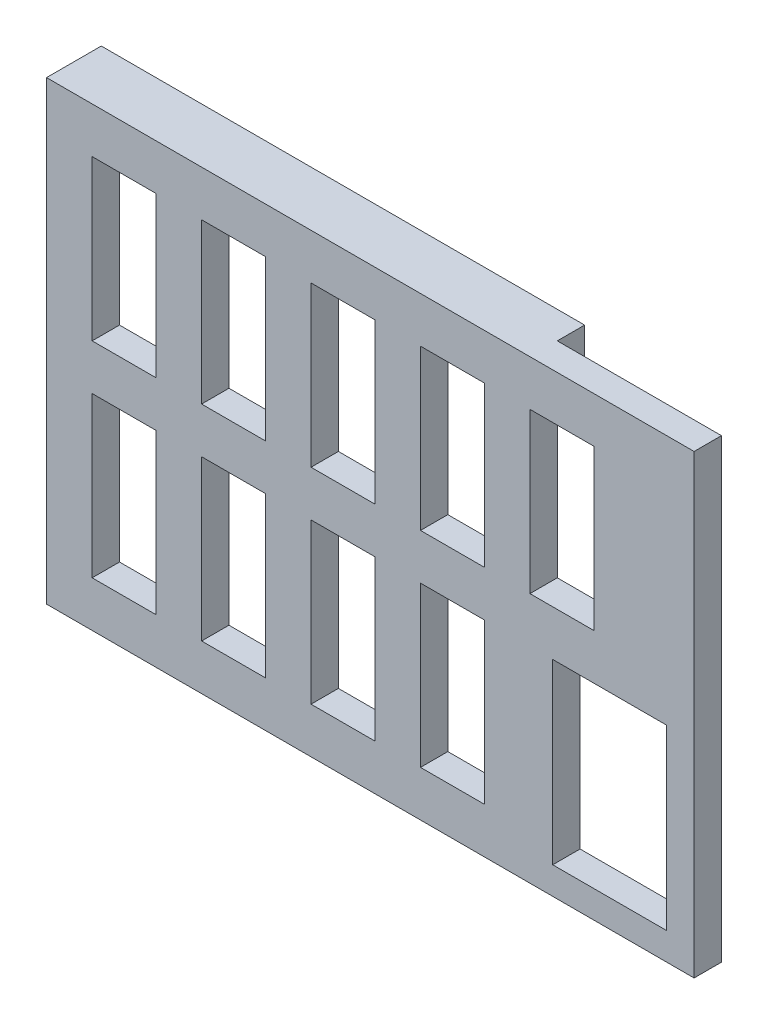
from build123d import *

# Parameters (mm, degrees)
EXTRUDE_1_DEPTH     = 5
SKETCH_2_W          = 53
SKETCH_2_H          = 3
EXTRUDE_2_DEPTH     = 3
SKETCH_3_W          = 53
SKETCH_3_H          = 50
EXTRUDE_3_DEPTH     = 3
SKETCH_4_W          = 3
SKETCH_4_H          = 50
EXTRUDE_4_DEPTH     = 18
SKETCH_5_W          = 7
SKETCH_5_H          = 17.5
CUT_EXTRUDE_1_DEPTH = 3
SKETCH_7_W          = 12.5
SKETCH_7_H          = 19.5
CUT_EXTRUDE_2_DEPTH = 3


with BuildPart() as part:
    # Эскиз1 → Бобышка-Вытянуть1 (new body)
    with BuildSketch(Plane(origin=(0, 0, 0), x_dir=(1, 0, 0), z_dir=(0, 1, 0))):
        Polygon((2.25, 0), (-2.25, 0), (-4, 3), (4, 3), align=None)
    extrude(amount=EXTRUDE_1_DEPTH)

    # Эскиз2 → Бобышка-Вытянуть2 (add)
    with BuildSketch(Plane(origin=(0, 5, 0), x_dir=(1, 0, 0), z_dir=(0, 1, 0))):
        with Locations((0, 1.5)):
            Rectangle(SKETCH_2_W, SKETCH_2_H)
    extrude(amount=EXTRUDE_2_DEPTH)

    # Эскиз3 → Бобышка-Вытянуть3 (add)
    with BuildSketch(Plane.XY):
        with Locations((0, -17)):
            Rectangle(SKETCH_3_W, SKETCH_3_H)
    extrude(amount=EXTRUDE_3_DEPTH)

    # Эскиз4 → Бобышка-Вытянуть4 (add)
    with BuildSketch(Plane(origin=(26.5, 0, 0), x_dir=(0, 0, -1), z_dir=(1, 0, 0))):
        with Locations((-1.5, -17)):
            Rectangle(SKETCH_4_W, SKETCH_4_H)
    extrude(amount=EXTRUDE_4_DEPTH)

    # Эскиз5 → Вырез-Вытянуть1 (cut)
    with BuildSketch(Plane.XY.offset(3)):
        with Locations((-18, -5.75)):
            Rectangle(SKETCH_5_W, SKETCH_5_H)
        with Locations((-18, -28.25)):
            Rectangle(SKETCH_5_W, SKETCH_5_H)
        with Locations((6, -5.75)):
            Rectangle(SKETCH_5_W, SKETCH_5_H)
        with Locations((6, -28.25)):
            Rectangle(SKETCH_5_W, SKETCH_5_H)
        with Locations((-6, -5.75)):
            Rectangle(SKETCH_5_W, SKETCH_5_H)
        with Locations((-6, -28.25)):
            Rectangle(SKETCH_5_W, SKETCH_5_H)
        with Locations((30, -5.75)):
            Rectangle(SKETCH_5_W, SKETCH_5_H)
        with Locations((18, -5.75)):
            Rectangle(SKETCH_5_W, SKETCH_5_H)
        with Locations((18, -28.25)):
            Rectangle(SKETCH_5_W, SKETCH_5_H)
    extrude(amount=-CUT_EXTRUDE_1_DEPTH, mode=Mode.SUBTRACT)

    # Эскиз7 → Вырез-Вытянуть2 (cut)
    with BuildSketch(Plane.XY.offset(3)):
        with Locations((35.25, -29.25)):
            Rectangle(SKETCH_7_W, SKETCH_7_H)
    extrude(amount=-CUT_EXTRUDE_2_DEPTH, mode=Mode.SUBTRACT)


solid = part.part
